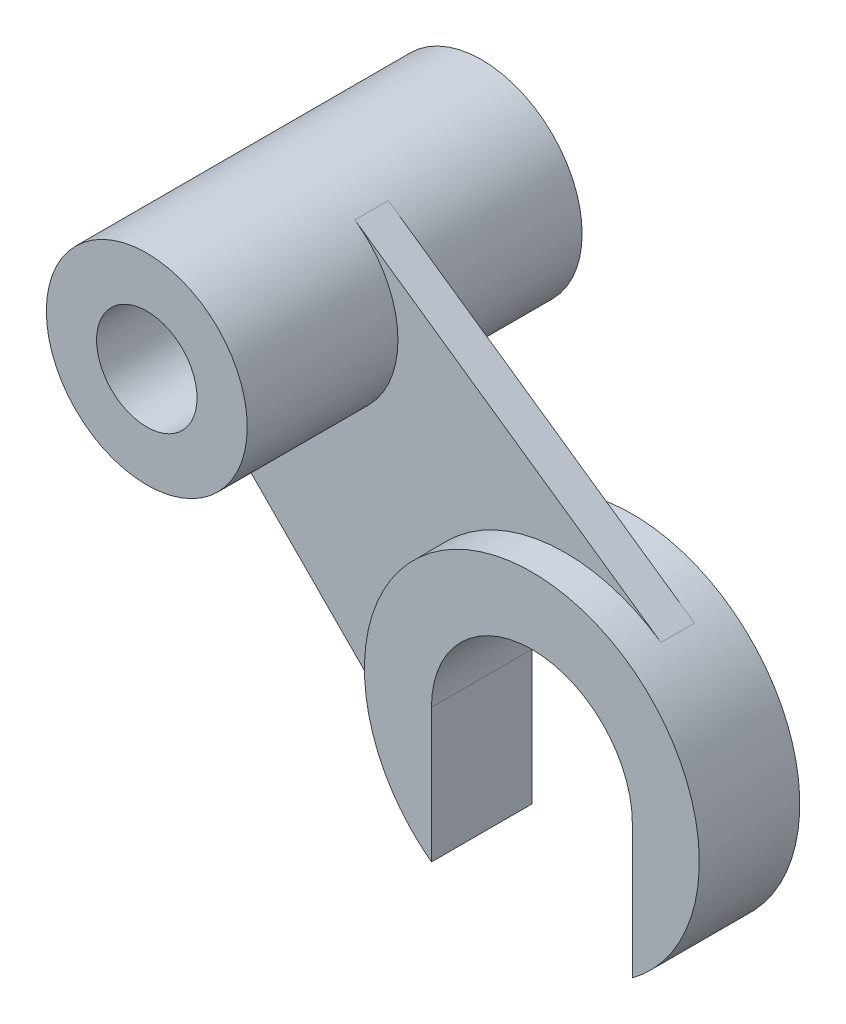
from build123d import *

# Parameters (mm, degrees)
SKETCH1_R             = 30
BOSS_EXTRUDE1_DEPTH   = 50
SKETCH2_R             = 50
BOSS_EXTRUDE2_DEPTH   = 15
BOSS_EXTRUDE3_DEPTH   = 5
CUT_EXTRUDE1_DEPTH    = 196
F_1_0MM_DOWEL_HOLE1_D = 30


with BuildPart() as part:
    # Sketch1 → Boss-Extrude1 (new, symmetric)
    with BuildSketch(Plane.XY):
        Circle(SKETCH1_R)
    extrude(amount=BOSS_EXTRUDE1_DEPTH, both=True)



with BuildPart() as body_2:
    # Sketch2 → Boss-Extrude2 (new, symmetric)
    with BuildSketch(Plane.XY):
        with Locations((80, -80)):
            Circle(SKETCH2_R)
    extrude(amount=BOSS_EXTRUDE2_DEPTH, both=True)


with BuildPart() as part_1:
    add(part.part)

    add(body_2.part)  # Boss-Extrude3 merges body 2
    # Sketch3 → Boss-Extrude3 (add, symmetric)
    with BuildSketch(Plane.XY):
        Polygon((17.129116361, 24.629116361), (108.548527268, -38.951472732), (44.477364607, -115.187247331), (-30, -40), (-30, 0), align=None)
    extrude(amount=BOSS_EXTRUDE3_DEPTH, both=True)

    # Sketch4 → Cut-Extrude1 (cut, through all)
    with BuildSketch(Plane.XY.offset(15)):
        with BuildLine():
            Line((110, -80), (110, -155.272597881))
            ThreePointArc((110, -155.272597881), (80, -185.272597881), (50, -155.272597881))
            Line((50, -155.272597881), (50, -80))
            ThreePointArc((50, -80), (80, -50), (110, -80))
        make_face()
    extrude(amount=-CUT_EXTRUDE1_DEPTH, mode=Mode.SUBTRACT)

    # Ø1.0mm Dowel Hole1 (through all)
    with Locations(Plane.XY.offset(50)):
        with Locations((0, 0)):
            Hole(F_1_0MM_DOWEL_HOLE1_D / 2)


solid = part_1.part
